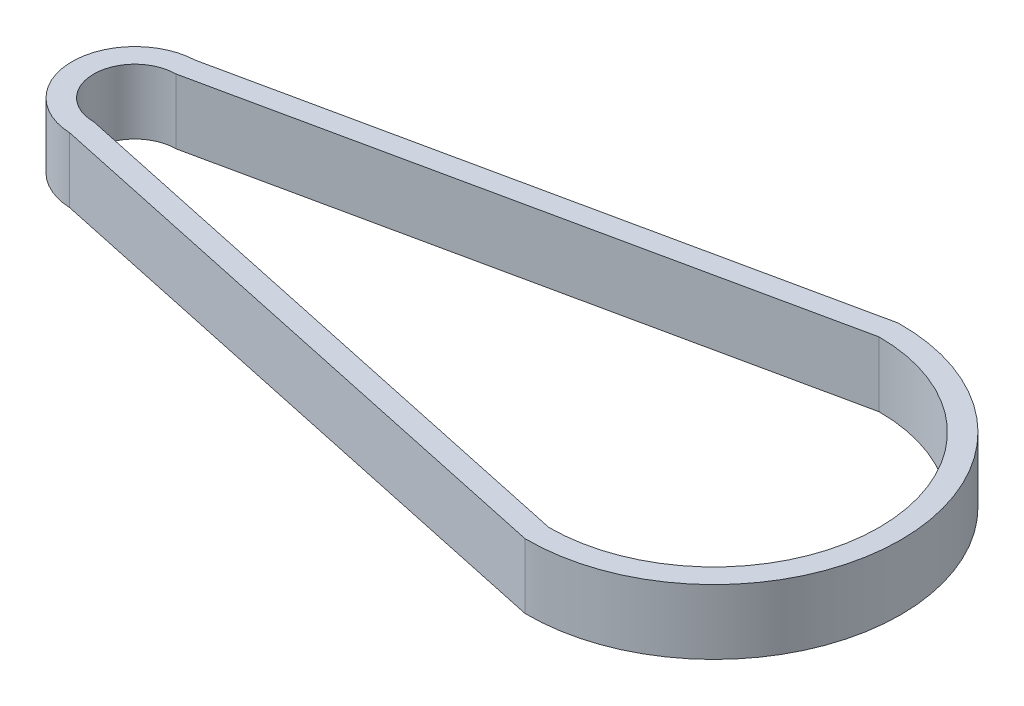
from build123d import *

# Parameters (mm, degrees)
BOSS_EXTRUDE1_DEPTH = 15


with BuildPart() as part:
    # Sketch1 → Boss-Extrude1 (new body)
    with BuildSketch(Plane(origin=(0, 0, 0), x_dir=(1, 0, 0), z_dir=(0, 1, 0))):
        with BuildLine():
            Line((-0.583159734, -14.538308867), (133.450472992, -43.191567642))
            ThreePointArc((133.450472992, -43.191567642), (177.19, 0), (133.450472992, 43.191567642))
            Line((133.450472992, 43.191567642), (-0.583159734, 14.538308867))
            ThreePointArc((-0.583159734, 14.538308867), (-14.55, 0), (-0.583159734, -14.538308867))
        make_face()
        with BuildLine():
            Line((0, 9.55), (133.995, 38.195))
            ThreePointArc((133.995, 38.195), (172.19, 0), (133.995, -38.195))
            Line((133.995, -38.195), (0, -9.55))
            ThreePointArc((0, -9.55), (-9.55, 0), (0, 9.55))
        make_face(mode=Mode.SUBTRACT)
    extrude(amount=BOSS_EXTRUDE1_DEPTH)


solid = part.part
